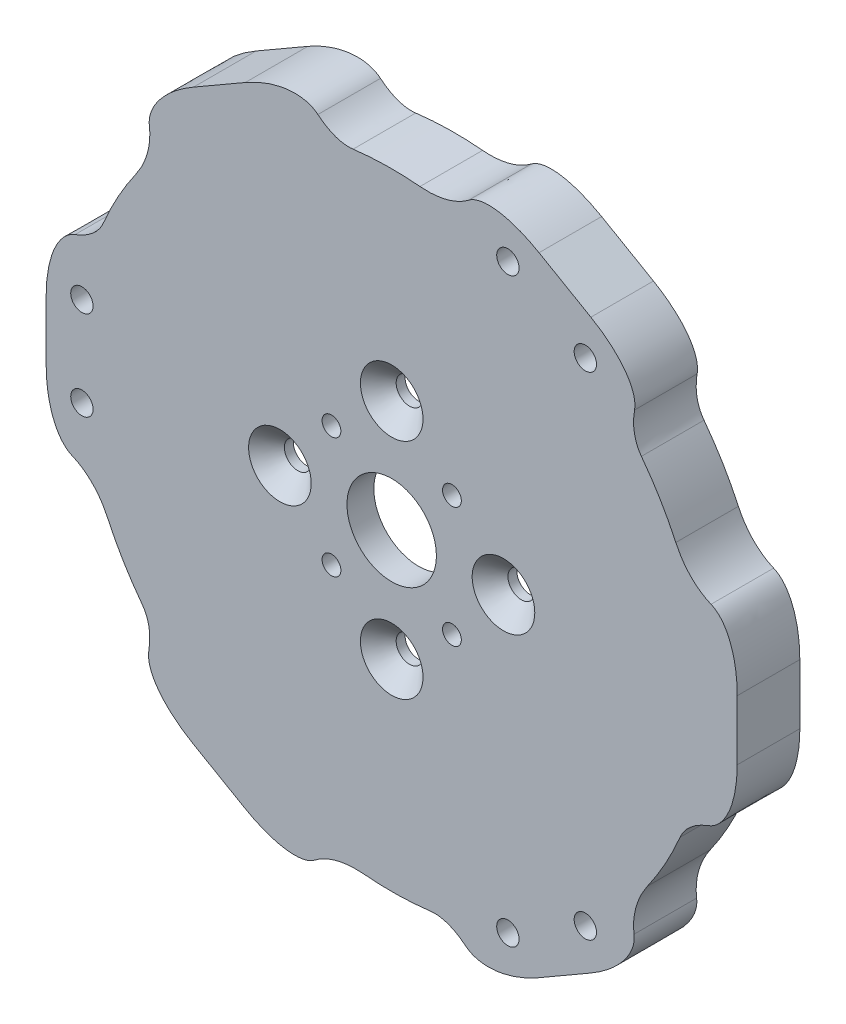
from build123d import *
from build123d.topology import SkipClean

# Parameters (mm, degrees)
SKETCH1_R           = 1.25
SKETCH1_R_2         = 1.5
SKETCH1_R_3         = 5
BOSS_EXTRUDE1_DEPTH = 3
CHAMFER1_SIZE       = 2
SKETCH2_R           = 1.05
CUT_EXTRUDE1_DEPTH  = 54.511909683
BOSS_EXTRUDE2_START = 4
SKETCH3_R           = 31.5
SKETCH3_R_2         = 1.25
BOSS_EXTRUDE2_DEPTH = 4
CUT_EXTRUDE2_DEPTH  = 4


with BuildPart() as part:
    # Sketch1 → Boss-Extrude1 (new body)
    with BuildSketch(Plane.XY):
        with BuildLine():
            Line((-16.368069353, 35.164093619), (-22.163123242, 31.818317696))
            add(Edge.make_bspline(
                [(-22.163123242, 31.818317696), (-24.146090422, 30.673374675), (-25.43857881, 29.292009814), (-26.232332907, 28.443674133), (-26.661508008, 27.603002778), (-27.216891121, 26.515114242), (-27.095302983, 25.585223863)],
                knots=[0, 0, 0, 0.5, 0.5, 0.75, 0.75, 1, 1, 1], degree=2))
            add(Edge.make_bspline(
                [(-27.095302983, 25.585223863), (-27.007749616, 24.918963781), (-27.069976938, 24.202184012), (-27.161954594, 23.142718176), (-27.572946477, 22.08387658), (-27.96313955, 21.078619123), (-28.605050634, 20.168070761)],
                knots=[0.344078416, 0.344078416, 0.344078416, 0.5, 0.5, 0.75, 0.75, 1, 1, 1], degree=2))
            ThreePointArc((-28.605050634, 20.168070761), (-30.596912671, 16.994967932), (-32.238194135, 13.627136124))
            add(Edge.make_bspline(
                [(-32.238194135, 13.627136124), (-32.594261005, 12.7848169), (-33.353880558, 12.107730246), (-34.025225451, 11.509327182), (-34.949714821, 11.097878217), (-35.173722086, 10.998182579), (-35.408029755, 10.911571092)],
                knots=[0, 0, 0, 0.25, 0.25, 0.5, 0.5, 0.567561023, 0.567561023, 0.567561023], degree=2))
            add(Edge.make_bspline(
                [(-35.408029755, 10.911571092), (-36.332452141, 10.570248424), (-37.055473673, 9.563828658), (-37.625782429, 8.76997954), (-38.006378353, 7.641953183), (-38.330725408, 6.680639613), (-38.491009776, 5.548294109), (-38.637025831, 4.516748589), (-38.637033052, 3.406882939)],
                knots=[0, 0, 0, 0.25, 0.25, 0.5, 0.5, 0.75, 0.75, 1, 1, 1], degree=2))
            Line((-38.637033052, 3.406882939), (-38.637033052, -3.284668906))
            add(Edge.make_bspline(
                [(-38.637033052, -3.284668906), (-38.636966899, -5.57444037), (-38.086914032, -7.384450578), (-37.749110829, -8.496029631), (-37.235655631, -9.28804185), (-36.571208078, -10.312962001), (-35.705105318, -10.672608775)],
                knots=[0, 0, 0, 0.5, 0.5, 0.75, 0.75, 1, 1, 1], degree=2))
            add(Edge.make_bspline(
                [(-35.705105318, -10.672608775), (-35.084330478, -10.929915376), (-34.49469465, -11.342195703), (-33.62315915, -11.951583606), (-32.911671371, -12.836933817), (-32.236189412, -13.677479658), (-31.768586941, -14.688665145)],
                knots=[0.344078416, 0.344078416, 0.344078416, 0.5, 0.5, 0.75, 0.75, 1, 1, 1], degree=2))
            ThreePointArc((-31.768586941, -14.688665145), (-30.016530301, -18.000219684), (-27.920543131, -21.105527031))
            add(Edge.make_bspline(
                [(-27.153714661, -25.208467374), (-27.112564325, -24.968052158), (-27.087116318, -24.729871026), (-26.979299731, -23.720759528), (-27.161275368, -22.837567986), (-27.367362076, -21.837356973), (-27.920543131, -21.105527031)],
                knots=[0.434124261, 0.434124261, 0.434124261, 0.5, 0.5, 0.75, 0.75, 1, 1, 1], degree=2))
            add(Edge.make_bspline(
                [(-22.268963699, -31.75721068), (-23.232301596, -31.201019151), (-24.054944377, -30.556540466), (-24.950291505, -29.855103399), (-25.618986509, -29.096157634), (-26.403918619, -28.205286763), (-26.807483295, -27.315196649), (-27.320875708, -26.182873782), (-27.153714661, -25.208467374)],
                knots=[0, 0, 0, 0.25, 0.25, 0.5, 0.5, 0.75, 0.75, 1, 1, 1], degree=2))
            Line((-22.268963699, -31.75721068), (-16.47390981, -35.102986603))
            add(Edge.make_bspline(
                [(-16.47390981, -35.102986603), (-14.490876477, -36.247815045), (-12.648335222, -36.676460392), (-11.516777923, -36.939703764), (-10.574147622, -36.891044628), (-9.354316958, -36.828076244), (-8.609802336, -36.257832638)],
                knots=[0, 0, 0, 0.5, 0.5, 0.75, 0.75, 1, 1, 1], degree=2))
            add(Edge.make_bspline(
                [(-8.609802336, -36.257832638), (-8.076580863, -35.848879157), (-7.424717712, -35.544379714), (-6.461204556, -35.094301782), (-5.338724894, -34.920810396), (-4.273049862, -34.756098781), (-3.163536307, -34.856735906)],
                knots=[0.344078416, 0.344078416, 0.344078416, 0.5, 0.5, 0.75, 0.75, 1, 1, 1], degree=2))
            ThreePointArc((-3.163536307, -34.856735906), (0.58038237, -34.995187616), (4.317651004, -34.732663155))
            add(Edge.make_bspline(
                [(4.317651004, -34.732663155), (5.225154284, -34.619866497), (6.191338304, -34.939173001), (7.045243005, -35.221373201), (7.863812947, -35.816279998), (8.062155534, -35.960428162), (8.254317117, -36.120038812)],
                knots=[0, 0, 0, 0.25, 0.25, 0.5, 0.5, 0.567561023, 0.567561023, 0.567561023], degree=2))
            add(Edge.make_bspline(
                [(8.254317117, -36.120038812), (9.012122411, -36.749950748), (10.245218261, -36.872895879), (11.217866142, -36.969873191), (12.385063586, -36.735465751), (13.379759086, -36.535701755), (14.440541242, -36.108339338), (15.406893894, -35.719020191), (16.368069353, -35.164093619)],
                knots=[0, 0, 0, 0.25, 0.25, 0.5, 0.5, 0.75, 0.75, 1, 1, 1], degree=2))
            Line((16.368069353, -35.164093619), (22.163123242, -31.818317696))
            add(Edge.make_bspline(
                [(22.163123242, -31.818317696), (24.146090422, -30.673374675), (25.43857881, -29.292009814), (26.232332907, -28.443674133), (26.661508008, -27.603002778), (27.216891121, -26.515114242), (27.095302983, -25.585223863)],
                knots=[0, 0, 0, 0.5, 0.5, 0.75, 0.75, 1, 1, 1], degree=2))
            add(Edge.make_bspline(
                [(27.095302983, -25.585223863), (27.007749616, -24.918963781), (27.069976938, -24.202184012), (27.161954594, -23.142718176), (27.572946477, -22.08387658), (27.96313955, -21.078619123), (28.605050634, -20.168070761)],
                knots=[0.344078416, 0.344078416, 0.344078416, 0.5, 0.5, 0.75, 0.75, 1, 1, 1], degree=2))
            ThreePointArc((28.605050634, -20.168070761), (30.596912671, -16.994967932), (32.238194135, -13.627136124))
            add(Edge.make_bspline(
                [(32.238194135, -13.627136124), (32.594261005, -12.7848169), (33.353880558, -12.107730246), (34.025225451, -11.509327182), (34.949714821, -11.097878217), (35.173722086, -10.998182579), (35.408029755, -10.911571092)],
                knots=[0, 0, 0, 0.25, 0.25, 0.5, 0.5, 0.567561023, 0.567561023, 0.567561023], degree=2))
            add(Edge.make_bspline(
                [(35.408029755, -10.911571092), (36.332452141, -10.570248424), (37.055473673, -9.563828658), (37.625782429, -8.76997954), (38.006378353, -7.641953183), (38.330725408, -6.680639613), (38.491009776, -5.548294109), (38.637025831, -4.516748589), (38.637033052, -3.406882939)],
                knots=[0, 0, 0, 0.25, 0.25, 0.5, 0.5, 0.75, 0.75, 1, 1, 1], degree=2))
            Line((38.637033052, -3.406882939), (38.637033052, 3.284668906))
            add(Edge.make_bspline(
                [(38.637033052, 3.284668906), (38.636966899, 5.57444037), (38.086914032, 7.384450578), (37.749110829, 8.496029631), (37.235655631, 9.28804185), (36.571208078, 10.312962001), (35.705105318, 10.672608775)],
                knots=[0, 0, 0, 0.5, 0.5, 0.75, 0.75, 1, 1, 1], degree=2))
            add(Edge.make_bspline(
                [(35.705105318, 10.672608775), (35.084330478, 10.929915376), (34.49469465, 11.342195703), (33.62315915, 11.951583606), (32.911671371, 12.836933817), (32.236189412, 13.677479658), (31.768586941, 14.688665145)],
                knots=[0.344078416, 0.344078416, 0.344078416, 0.5, 0.5, 0.75, 0.75, 1, 1, 1], degree=2))
            ThreePointArc((31.768586941, 14.688665145), (30.016530301, 18.000219684), (27.920543131, 21.105527031))
            add(Edge.make_bspline(
                [(27.920543131, 21.105527031), (27.36910672, 21.835049598), (27.162542254, 22.831442755), (26.979982446, 23.712046019), (27.085901874, 24.718401782), (27.111566552, 24.962245583), (27.153712639, 25.20846772)],
                knots=[0, 0, 0, 0.25, 0.25, 0.5, 0.5, 0.567561023, 0.567561023, 0.567561023], degree=2))
            add(Edge.make_bspline(
                [(27.153712639, 25.20846772), (27.32032973, 26.179702324), (26.810255412, 27.309067221), (26.407916287, 28.19989365), (25.621314767, 29.093512568), (24.950966322, 29.855062142), (24.050468534, 30.560045229), (23.230131936, 31.202271601), (22.268963699, 31.75721068)],
                knots=[0, 0, 0, 0.25, 0.25, 0.5, 0.5, 0.75, 0.75, 1, 1, 1], degree=2))
            Line((22.268963699, 31.75721068), (16.47390981, 35.102986603))
            add(Edge.make_bspline(
                [(16.47390981, 35.102986603), (14.490876477, 36.247815045), (12.648335222, 36.676460392), (11.516777923, 36.939703764), (10.574147622, 36.891044628), (9.354316958, 36.828076244), (8.609802336, 36.257832638)],
                knots=[0, 0, 0, 0.5, 0.5, 0.75, 0.75, 1, 1, 1], degree=2))
            add(Edge.make_bspline(
                [(8.609802336, 36.257832638), (8.076580863, 35.848879157), (7.424717712, 35.544379714), (6.461204556, 35.094301782), (5.338724894, 34.920810396), (4.273049862, 34.756098781), (3.163536307, 34.856735906)],
                knots=[0.344078416, 0.344078416, 0.344078416, 0.5, 0.5, 0.75, 0.75, 1, 1, 1], degree=2))
            ThreePointArc((3.163536307, 34.856735906), (-0.58038237, 34.995187616), (-4.317651004, 34.732663155))
            add(Edge.make_bspline(
                [(-4.317651004, 34.732663155), (-5.225154284, 34.619866497), (-6.191338304, 34.939173001), (-7.045243005, 35.221373201), (-7.863812947, 35.816279998), (-8.062155534, 35.960428162), (-8.254317117, 36.120038812)],
                knots=[0, 0, 0, 0.25, 0.25, 0.5, 0.5, 0.567561023, 0.567561023, 0.567561023], degree=2))
            add(Edge.make_bspline(
                [(-8.254317117, 36.120038812), (-9.012122411, 36.749950748), (-10.245218261, 36.872895879), (-11.217866142, 36.969873191), (-12.385063586, 36.735465751), (-13.379759086, 36.535701755), (-14.440541242, 36.108339338), (-15.406893894, 35.719020191), (-16.368069353, 35.164093619)],
                knots=[0, 0, 0, 0.25, 0.25, 0.5, 0.5, 0.75, 0.75, 1, 1, 1], degree=2))
        make_face()
        with Locations((-34.641016151, -5)):
            Circle(SKETCH1_R, mode=Mode.SUBTRACT)
        with Locations((-34.641016151, 5)):
            Circle(SKETCH1_R, mode=Mode.SUBTRACT)
        with Locations((12.990381057, 32.5)):
            Circle(SKETCH1_R, mode=Mode.SUBTRACT)
        with Locations((21.650635095, 27.5)):
            Circle(SKETCH1_R, mode=Mode.SUBTRACT)
        with Locations((21.650635095, -27.5)):
            Circle(SKETCH1_R, mode=Mode.SUBTRACT)
        with Locations((12.990381057, -32.5)):
            Circle(SKETCH1_R, mode=Mode.SUBTRACT)
        with Locations((0, -12.5)):
            Circle(SKETCH1_R_2, mode=Mode.SUBTRACT)
        with Locations((-12.5, 0)):
            Circle(SKETCH1_R_2, mode=Mode.SUBTRACT)
        with Locations((0, 12.5)):
            Circle(SKETCH1_R_2, mode=Mode.SUBTRACT)
        with Locations((12.5, 0)):
            Circle(SKETCH1_R_2, mode=Mode.SUBTRACT)
        Circle(SKETCH1_R_3, mode=Mode.SUBTRACT)
    extrude(amount=BOSS_EXTRUDE1_DEPTH)

    # Chamfer1
    chamfer1_edges = [part.edges().sort_by_distance(p)[0] for p in [
        (11, 0, 3),
        (-1.5, 12.5, 3),
        (-14, 0, 3),
        (-1.5, -12.5, 3),
    ]]
    chamfer(chamfer1_edges, length=CHAMFER1_SIZE)

    # Sketch2 → Cut-Extrude1 (cut, through all)
    with BuildSketch(Plane.XY.offset(3)):
        with Locations((-6.735192091, 6.735192091)):
            Circle(SKETCH2_R)
        with Locations((6.735192091, 6.735192091)):
            Circle(SKETCH2_R)
        with Locations((6.735192091, -6.735192091)):
            Circle(SKETCH2_R)
        with Locations((-6.735192091, -6.735192091)):
            Circle(SKETCH2_R)
    extrude(amount=-CUT_EXTRUDE1_DEPTH, mode=Mode.SUBTRACT)

    # Sketch3 → Boss-Extrude2 (add)
    with SkipClean():  # the faces are left unmerged after this step: merging them gives an invalid solid
        with BuildSketch(Plane(origin=(0, 0, 0), x_dir=(-1, 0, 0), z_dir=(0, 0, -1)).offset(BOSS_EXTRUDE2_START)):
            with BuildLine():
                Line((38.637033052, -3.284668906), (38.637033052, 3.406882939))
                add(Edge.make_bspline(
                    [(38.637033052, 3.406882939), (38.637025831, 4.516748589), (38.491009776, 5.548294109), (38.330725408, 6.680639613), (38.006378353, 7.641953183), (37.625782429, 8.76997954), (37.055473673, 9.563828658), (36.332452141, 10.570248424), (35.408029755, 10.911571092)],
                    knots=[0, 0, 0, 0.25, 0.25, 0.5, 0.5, 0.75, 0.75, 1, 1, 1], degree=2))
                add(Edge.make_bspline(
                    [(35.408029755, 10.911571092), (35.173722086, 10.998182579), (34.949714821, 11.097878217), (34.025225451, 11.509327182), (33.353880558, 12.107730246), (32.594261005, 12.7848169), (32.238194135, 13.627136124)],
                    knots=[0, 0, 0, 0.067561023, 0.067561023, 0.317561023, 0.317561023, 0.567561023, 0.567561023, 0.567561023], degree=2))
                ThreePointArc((32.238194135, 13.627136124), (30.596912671, 16.994967932), (28.605050634, 20.168070761))
                add(Edge.make_bspline(
                    [(28.605050634, 20.168070761), (27.96313955, 21.078619123), (27.572946477, 22.08387658), (27.161954594, 23.142718176), (27.069976938, 24.202184012), (27.007749616, 24.918963781), (27.095302983, 25.585223863)],
                    knots=[0.344078416, 0.344078416, 0.344078416, 0.594078416, 0.594078416, 0.844078416, 0.844078416, 1, 1, 1], degree=2))
                add(Edge.make_bspline(
                    [(27.095302983, 25.585223863), (27.216891121, 26.515114242), (26.661508008, 27.603002778), (26.232332907, 28.443674133), (25.43857881, 29.292009814), (24.146090422, 30.673374675), (22.163123242, 31.818317696)],
                    knots=[0, 0, 0, 0.25, 0.25, 0.5, 0.5, 1, 1, 1], degree=2))
                Line((22.163123242, 31.818317696), (16.368069353, 35.164093619))
                add(Edge.make_bspline(
                    [(16.368069353, 35.164093619), (15.406893894, 35.719020191), (14.440541242, 36.108339338), (13.379759086, 36.535701755), (12.385063586, 36.735465751), (11.217866142, 36.969873191), (10.245218261, 36.872895879), (9.012122411, 36.749950748), (8.254317117, 36.120038812)],
                    knots=[0, 0, 0, 0.25, 0.25, 0.5, 0.5, 0.75, 0.75, 1, 1, 1], degree=2))
                add(Edge.make_bspline(
                    [(8.254317117, 36.120038812), (8.062155534, 35.960428162), (7.863812947, 35.816279998), (7.045243005, 35.221373201), (6.191338304, 34.939173001), (5.225154284, 34.619866497), (4.317651004, 34.732663155)],
                    knots=[0, 0, 0, 0.067561023, 0.067561023, 0.317561023, 0.317561023, 0.567561023, 0.567561023, 0.567561023], degree=2))
                ThreePointArc((4.317651004, 34.732663155), (0.58038237, 34.995187616), (-3.163536307, 34.856735906))
                add(Edge.make_bspline(
                    [(-3.163536307, 34.856735906), (-4.273049862, 34.756098781), (-5.338724894, 34.920810396), (-6.461204556, 35.094301782), (-7.424717712, 35.544379714), (-8.076580863, 35.848879157), (-8.609802336, 36.257832638)],
                    knots=[0.344078416, 0.344078416, 0.344078416, 0.594078416, 0.594078416, 0.844078416, 0.844078416, 1, 1, 1], degree=2))
                add(Edge.make_bspline(
                    [(-8.609802336, 36.257832638), (-9.354316958, 36.828076244), (-10.574147622, 36.891044628), (-11.516777923, 36.939703764), (-12.648335222, 36.676460392), (-14.490876477, 36.247815045), (-16.47390981, 35.102986603)],
                    knots=[0, 0, 0, 0.25, 0.25, 0.5, 0.5, 1, 1, 1], degree=2))
                Line((-16.47390981, 35.102986603), (-22.268963699, 31.75721068))
                add(Edge.make_bspline(
                    [(-22.268963699, 31.75721068), (-23.230131936, 31.202271601), (-24.050468534, 30.560045229), (-24.950966322, 29.855062142), (-25.621314767, 29.093512568), (-26.407916287, 28.19989365), (-26.810255412, 27.309067221), (-27.32032973, 26.179702324), (-27.153712639, 25.20846772)],
                    knots=[0, 0, 0, 0.25, 0.25, 0.5, 0.5, 0.75, 0.75, 1, 1, 1], degree=2))
                add(Edge.make_bspline(
                    [(-27.153712639, 25.20846772), (-27.111566552, 24.962245583), (-27.085901874, 24.718401782), (-26.979982446, 23.712046019), (-27.162542254, 22.831442755), (-27.36910672, 21.835049598), (-27.920543131, 21.105527031)],
                    knots=[0, 0, 0, 0.067561023, 0.067561023, 0.317561023, 0.317561023, 0.567561023, 0.567561023, 0.567561023], degree=2))
                ThreePointArc((-27.920543131, 21.105527031), (-30.016530301, 18.000219684), (-31.768586941, 14.688665145))
                add(Edge.make_bspline(
                    [(-31.768586941, 14.688665145), (-32.236189412, 13.677479658), (-32.911671371, 12.836933817), (-33.62315915, 11.951583606), (-34.49469465, 11.342195703), (-35.084330478, 10.929915376), (-35.705105318, 10.672608775)],
                    knots=[0.344078416, 0.344078416, 0.344078416, 0.594078416, 0.594078416, 0.844078416, 0.844078416, 1, 1, 1], degree=2))
                add(Edge.make_bspline(
                    [(-35.705105318, 10.672608775), (-36.571208078, 10.312962001), (-37.235655631, 9.28804185), (-37.749110829, 8.496029631), (-38.086914032, 7.384450578), (-38.636966899, 5.57444037), (-38.637033052, 3.284668906)],
                    knots=[0, 0, 0, 0.25, 0.25, 0.5, 0.5, 1, 1, 1], degree=2))
                Line((-38.637033052, 3.284668906), (-38.637033052, -3.406882939))
                add(Edge.make_bspline(
                    [(-38.637033052, -3.406882939), (-38.637025831, -4.516748589), (-38.491009776, -5.548294109), (-38.330725408, -6.680639613), (-38.006378353, -7.641953183), (-37.625782429, -8.76997954), (-37.055473673, -9.563828658), (-36.332452141, -10.570248424), (-35.408029755, -10.911571092)],
                    knots=[0, 0, 0, 0.25, 0.25, 0.5, 0.5, 0.75, 0.75, 1, 1, 1], degree=2))
                add(Edge.make_bspline(
                    [(-35.408029755, -10.911571092), (-35.173722086, -10.998182579), (-34.949714821, -11.097878217), (-34.025225451, -11.509327182), (-33.353880558, -12.107730246), (-32.594261005, -12.7848169), (-32.238194135, -13.627136124)],
                    knots=[0, 0, 0, 0.067561023, 0.067561023, 0.317561023, 0.317561023, 0.567561023, 0.567561023, 0.567561023], degree=2))
                ThreePointArc((-32.238194135, -13.627136124), (-30.596912671, -16.994967932), (-28.605050634, -20.168070761))
                add(Edge.make_bspline(
                    [(-28.605050634, -20.168070761), (-27.96313955, -21.078619123), (-27.572946477, -22.08387658), (-27.161954594, -23.142718176), (-27.069976938, -24.202184012), (-27.007749616, -24.918963781), (-27.095302983, -25.585223863)],
                    knots=[0.344078416, 0.344078416, 0.344078416, 0.594078416, 0.594078416, 0.844078416, 0.844078416, 1, 1, 1], degree=2))
                add(Edge.make_bspline(
                    [(-27.095302983, -25.585223863), (-27.216891121, -26.515114242), (-26.661508008, -27.603002778), (-26.232332907, -28.443674133), (-25.43857881, -29.292009814), (-24.146090422, -30.673374675), (-22.163123242, -31.818317696)],
                    knots=[0, 0, 0, 0.25, 0.25, 0.5, 0.5, 1, 1, 1], degree=2))
                Line((-22.163123242, -31.818317696), (-16.368069353, -35.164093619))
                add(Edge.make_bspline(
                    [(-16.368069353, -35.164093619), (-15.406893894, -35.719020191), (-14.440541242, -36.108339338), (-13.379759086, -36.535701755), (-12.385063586, -36.735465751), (-11.217866142, -36.969873191), (-10.245218261, -36.872895879), (-9.012122411, -36.749950748), (-8.254317117, -36.120038812)],
                    knots=[0, 0, 0, 0.25, 0.25, 0.5, 0.5, 0.75, 0.75, 1, 1, 1], degree=2))
                add(Edge.make_bspline(
                    [(-8.254317117, -36.120038812), (-8.062155534, -35.960428162), (-7.863812947, -35.816279998), (-7.045243005, -35.221373201), (-6.191338304, -34.939173001), (-5.225154284, -34.619866497), (-4.317651004, -34.732663155)],
                    knots=[0, 0, 0, 0.067561023, 0.067561023, 0.317561023, 0.317561023, 0.567561023, 0.567561023, 0.567561023], degree=2))
                ThreePointArc((-4.317651004, -34.732663155), (-0.58038237, -34.995187616), (3.163536307, -34.856735906))
                add(Edge.make_bspline(
                    [(3.163536307, -34.856735906), (4.273049862, -34.756098781), (5.338724894, -34.920810396), (6.461204556, -35.094301782), (7.424717712, -35.544379714), (8.076580863, -35.848879157), (8.609802336, -36.257832638)],
                    knots=[0.344078416, 0.344078416, 0.344078416, 0.594078416, 0.594078416, 0.844078416, 0.844078416, 1, 1, 1], degree=2))
                add(Edge.make_bspline(
                    [(8.609802336, -36.257832638), (9.354316958, -36.828076244), (10.574147622, -36.891044628), (11.516777923, -36.939703764), (12.648335222, -36.676460392), (14.490876477, -36.247815045), (16.47390981, -35.102986603)],
                    knots=[0, 0, 0, 0.25, 0.25, 0.5, 0.5, 1, 1, 1], degree=2))
                Line((16.47390981, -35.102986603), (22.268963699, -31.75721068))
                add(Edge.make_bspline(
                    [(22.268963699, -31.75721068), (23.232301596, -31.201019151), (24.054944377, -30.556540466), (24.950291505, -29.855103399), (25.618986509, -29.096157634), (26.403918619, -28.205286763), (26.807483295, -27.315196649), (27.320875708, -26.182873782), (27.153714661, -25.208467374)],
                    knots=[0, 0, 0, 0.25, 0.25, 0.5, 0.5, 0.75, 0.75, 1, 1, 1], degree=2))
                add(Edge.make_bspline(
                    [(27.153714661, -25.208467374), (27.112564325, -24.968052158), (27.087116318, -24.729871026), (26.979299731, -23.720759528), (27.161275368, -22.837567986), (27.367362076, -21.837356973), (27.920543131, -21.105527031)],
                    knots=[0.434124261, 0.434124261, 0.434124261, 0.5, 0.5, 0.75, 0.75, 1, 1, 1], degree=2))
                ThreePointArc((27.920543131, -21.105527031), (30.016530301, -18.000219684), (31.768586941, -14.688665145))
                add(Edge.make_bspline(
                    [(31.768586941, -14.688665145), (32.236189412, -13.677479658), (32.911671371, -12.836933817), (33.62315915, -11.951583606), (34.49469465, -11.342195703), (35.084330478, -10.929915376), (35.705105318, -10.672608775)],
                    knots=[0.344078416, 0.344078416, 0.344078416, 0.594078416, 0.594078416, 0.844078416, 0.844078416, 1, 1, 1], degree=2))
                add(Edge.make_bspline(
                    [(35.705105318, -10.672608775), (36.571208078, -10.312962001), (37.235655631, -9.28804185), (37.749110829, -8.496029631), (38.086914032, -7.384450578), (38.636966899, -5.57444037), (38.637033052, -3.284668906)],
                    knots=[0, 0, 0, 0.25, 0.25, 0.5, 0.5, 1, 1, 1], degree=2))
            make_face()
            Circle(SKETCH3_R, mode=Mode.SUBTRACT)
            with Locations((-12.990381057, -32.5)):
                Circle(SKETCH3_R_2, mode=Mode.SUBTRACT)
            with Locations((-21.650635095, -27.5)):
                Circle(SKETCH3_R_2, mode=Mode.SUBTRACT)
            with Locations((-21.650635095, 27.5)):
                Circle(SKETCH3_R_2, mode=Mode.SUBTRACT)
            with Locations((-12.990381057, 32.5)):
                Circle(SKETCH3_R_2, mode=Mode.SUBTRACT)
            with Locations((34.641016151, -5)):
                Circle(SKETCH3_R_2, mode=Mode.SUBTRACT)
            with Locations((34.641016151, 5)):
                Circle(SKETCH3_R_2, mode=Mode.SUBTRACT)
        extrude(amount=-BOSS_EXTRUDE2_DEPTH)

    # Sketch4 → Cut-Extrude2 (cut)
    with SkipClean():  # the faces are left unmerged after this step: merging them gives an invalid solid
        with BuildSketch(Plane(origin=(0, 0, -4), x_dir=(-1, 0, 0), z_dir=(0, 0, -1))):
            Polygon((39.843270488, -40.229183692), (17.097003278, -13.333782428), (10.513474272, -18.901675187), (33.259741482, -45.797076451), align=None)
        extrude(amount=-CUT_EXTRUDE2_DEPTH, mode=Mode.SUBTRACT)


solid = part.part
